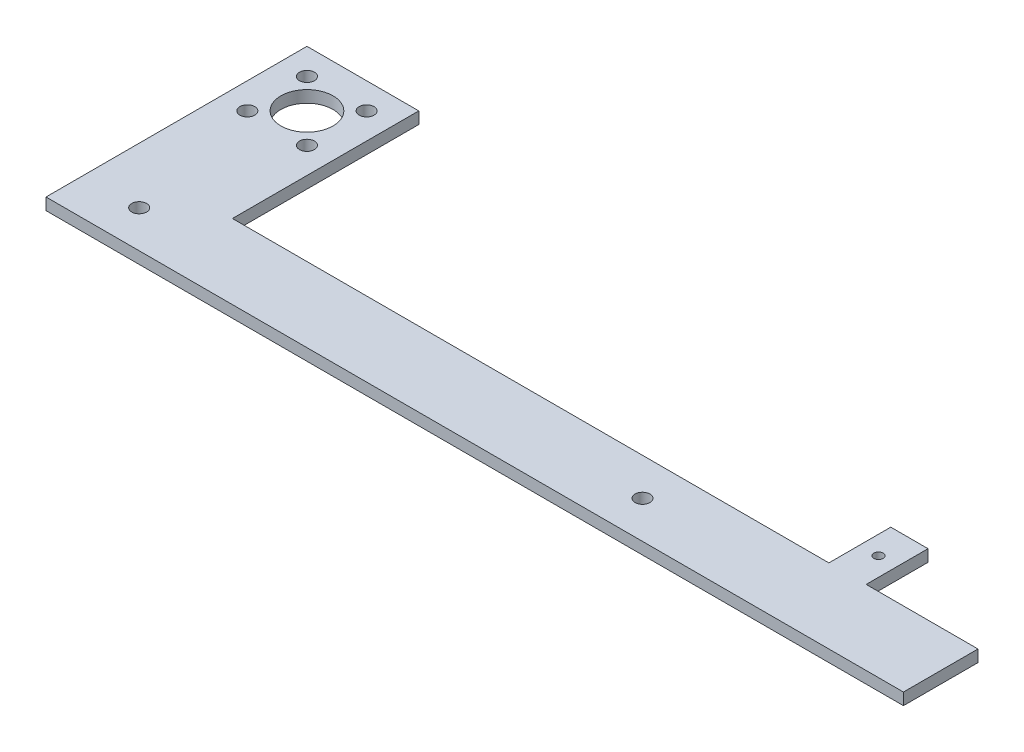
from build123d import *

# Parameters (mm, degrees)
SKETCH1_R           = 2
SKETCH1_R_2         = 1.25
BOSS_EXTRUDE1_DEPTH = 3.175


with BuildPart() as part:
    # Sketch1 → Boss-Extrude1 (new body)
    with BuildSketch(Plane(origin=(0, 0, 0), x_dir=(1, 0, 0), z_dir=(0, 1, 0))):
        Polygon((230, 0), (230, 10), (230, 20), (200, 20), (200, 36.6), (195, 36.6), (190, 36.6), (190, 20), (30, 20), (30, 70), (15, 70), (0, 70), (0, 0), align=None)
        with Locations((15, 10)):
            Circle(SKETCH1_R, mode=Mode.SUBTRACT)
        with BuildLine():
            ThreePointArc((148, 10), (150, 12), (152, 10))
            ThreePointArc((152, 10), (150, 8), (148, 10))
        make_face(mode=Mode.SUBTRACT)
        with Locations((7, 47)):
            Circle(SKETCH1_R, mode=Mode.SUBTRACT)
        with Locations((23, 47)):
            Circle(SKETCH1_R, mode=Mode.SUBTRACT)
        with BuildLine():
            ThreePointArc((10.050252532, 59.949747468), (12.321215973, 61.467156728), (15, 62))
            ThreePointArc((15, 62), (17.678784027, 48.532843272), (10.050252532, 59.949747468))
        make_face(mode=Mode.SUBTRACT)
        with Locations((7, 63)):
            Circle(SKETCH1_R, mode=Mode.SUBTRACT)
        with Locations((23, 63)):
            Circle(SKETCH1_R, mode=Mode.SUBTRACT)
        with Locations((195, 28.3)):
            Circle(SKETCH1_R_2, mode=Mode.SUBTRACT)
    extrude(amount=BOSS_EXTRUDE1_DEPTH)


solid = part.part
